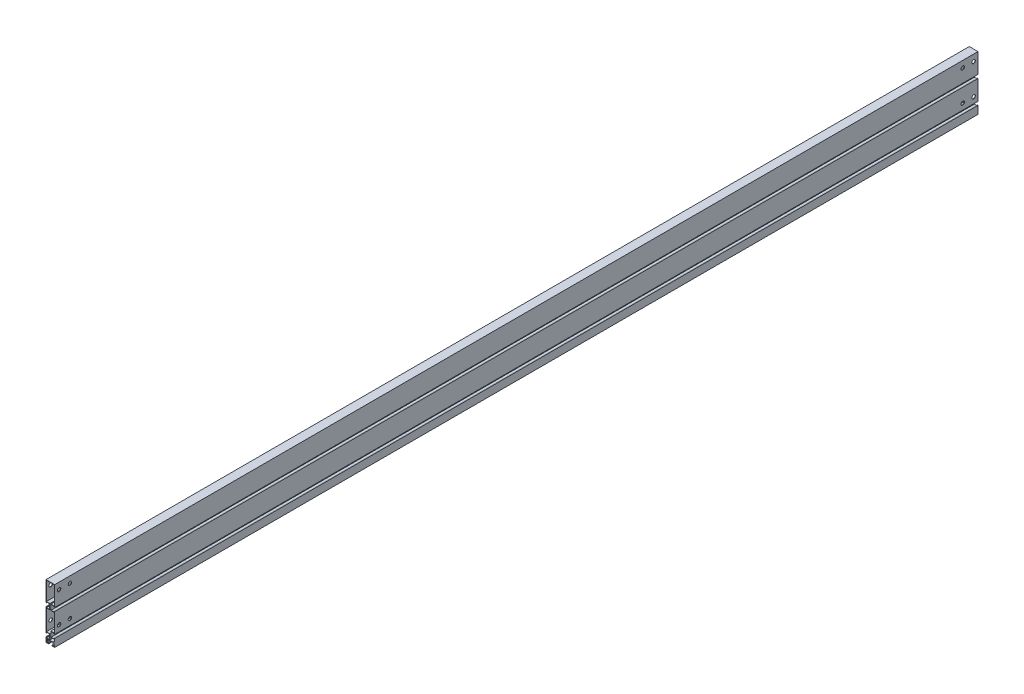
from build123d import *

# Parameters (mm, degrees)
BOSS_EXTRUDE1_DEPTH = 1060
CUT_EXTRUDE1_REACH  = 1064.029
SKETCH2_R           = 4


with BuildPart() as part:
    # Sketch1 → Boss-Extrude1 (new, symmetric)
    with BuildSketch(Plane.XY):
        Polygon((-10, -43), (-10, 9), (-8.5, 9), (-8.5, 7.5), (-2, 7.5), (-2, 18.5), (-8.5, 18.5), (-8.5, 17), (-10, 17), (-10, 62.5), (10, 62.5), (10, 17), (8.5, 17), (8.5, 18.5), (2, 18.5), (2, 7.5), (8.5, 7.5), (8.5, 9), (10, 9), (10, -36.5), (8.5, -36.5), (8.5, -35), (2, -35), (2, -46), (8.5, -46), (8.5, -44.5), (10, -44.5), (10, -62.5), (4, -62.5), (4, -61), (5.5, -61), (5.5, -54.5), (-5.5, -54.5), (-5.5, -61), (-4, -61), (-4, -62.5), (-10, -62.5), (-10, -51), (-8.5, -51), (-8.5, -52.5), (-2, -52.5), (-2, -41.5), (-8.5, -41.5), (-8.5, -43), align=None)
        Polygon((-9.2, 19.3), (-9.2, 61.7), (9.2, 61.7), (9.2, 19.3), (1.2, 19.3), (1.2, 6.7), (9.2, 6.7), (9.2, -34.2), (1.2, -34.2), (1.2, -46.8), (9.2, -46.8), (9.2, -61.7), (6.3, -61.7), (6.3, -53.7), (-6.3, -53.7), (-6.3, -61.7), (-9.2, -61.7), (-9.2, -53.3), (-1.2, -53.3), (-1.2, -40.7), (-9.2, -40.7), (-9.2, 6.7), (-1.2, 6.7), (-1.2, 19.3), align=None, mode=Mode.SUBTRACT)
    extrude(amount=BOSS_EXTRUDE1_DEPTH, both=True)

    # Cut-Extrude1: up to this face of the body (flat: up to its plane)
    cut_extrude1_end = Plane(part.part.faces().sort_by_distance((10, 39.75, 0))[0])
    # Sketch2 → Cut-Extrude1 (cut, up to the picked face)
    with BuildSketch(Plane.ZY.offset(10), mode=Mode.PRIVATE) as cut_extrude1_sk1:
        with Locations((1025, 47.5)):
            Circle(SKETCH2_R)
    cut_extrude1_tool1 = split(extrude(cut_extrude1_sk1.sketch, amount=-CUT_EXTRUDE1_REACH, mode=Mode.PRIVATE), bisect_by=cut_extrude1_end, keep=Keep.BOTH, mode=Mode.PRIVATE)
    # Sketch2 → Cut-Extrude1 (cut, up to the picked face)
    with BuildSketch(Plane.ZY.offset(10), mode=Mode.PRIVATE) as cut_extrude1_sk2:
        with Locations((1050, 47.5)):
            Circle(SKETCH2_R)
    cut_extrude1_tool2 = split(extrude(cut_extrude1_sk2.sketch, amount=-CUT_EXTRUDE1_REACH, mode=Mode.PRIVATE), bisect_by=cut_extrude1_end, keep=Keep.BOTH, mode=Mode.PRIVATE)
    # Sketch2 → Cut-Extrude1 (cut, up to the picked face)
    with BuildSketch(Plane.ZY.offset(10), mode=Mode.PRIVATE) as cut_extrude1_sk3:
        with Locations((1025, -22.5)):
            Circle(SKETCH2_R)
    cut_extrude1_tool3 = split(extrude(cut_extrude1_sk3.sketch, amount=-CUT_EXTRUDE1_REACH, mode=Mode.PRIVATE), bisect_by=cut_extrude1_end, keep=Keep.BOTH, mode=Mode.PRIVATE)
    # Sketch2 → Cut-Extrude1 (cut, up to the picked face)
    with BuildSketch(Plane.ZY.offset(10), mode=Mode.PRIVATE) as cut_extrude1_sk4:
        with Locations((1050, -22.5)):
            Circle(SKETCH2_R)
    cut_extrude1_tool4 = split(extrude(cut_extrude1_sk4.sketch, amount=-CUT_EXTRUDE1_REACH, mode=Mode.PRIVATE), bisect_by=cut_extrude1_end, keep=Keep.BOTH, mode=Mode.PRIVATE)
    cut_extrude1_1 = cut_extrude1_tool1.solids().sort_by(Axis((-10, 47.5, 1025), (1, 0, 0)))[0]
    add(cut_extrude1_1, mode=Mode.SUBTRACT)
    cut_extrude1_2 = cut_extrude1_tool2.solids().sort_by(Axis((-10, 47.5, 1050), (1, 0, 0)))[0]
    add(cut_extrude1_2, mode=Mode.SUBTRACT)
    cut_extrude1_3 = cut_extrude1_tool3.solids().sort_by(Axis((-10, -22.5, 1025), (1, 0, 0)))[0]
    add(cut_extrude1_3, mode=Mode.SUBTRACT)
    cut_extrude1_4 = cut_extrude1_tool4.solids().sort_by(Axis((-10, -22.5, 1050), (1, 0, 0)))[0]
    add(cut_extrude1_4, mode=Mode.SUBTRACT)
    cut_extrude1 = cut_extrude1_1 + cut_extrude1_2 + cut_extrude1_3 + cut_extrude1_4  # Cut-Extrude1 as one shape, for the pattern or mirror that repeats it

    # Mirror1: Cut-Extrude1 across plane
    add(cut_extrude1.mirror(Plane.XY), mode=Mode.SUBTRACT)


solid = part.part
